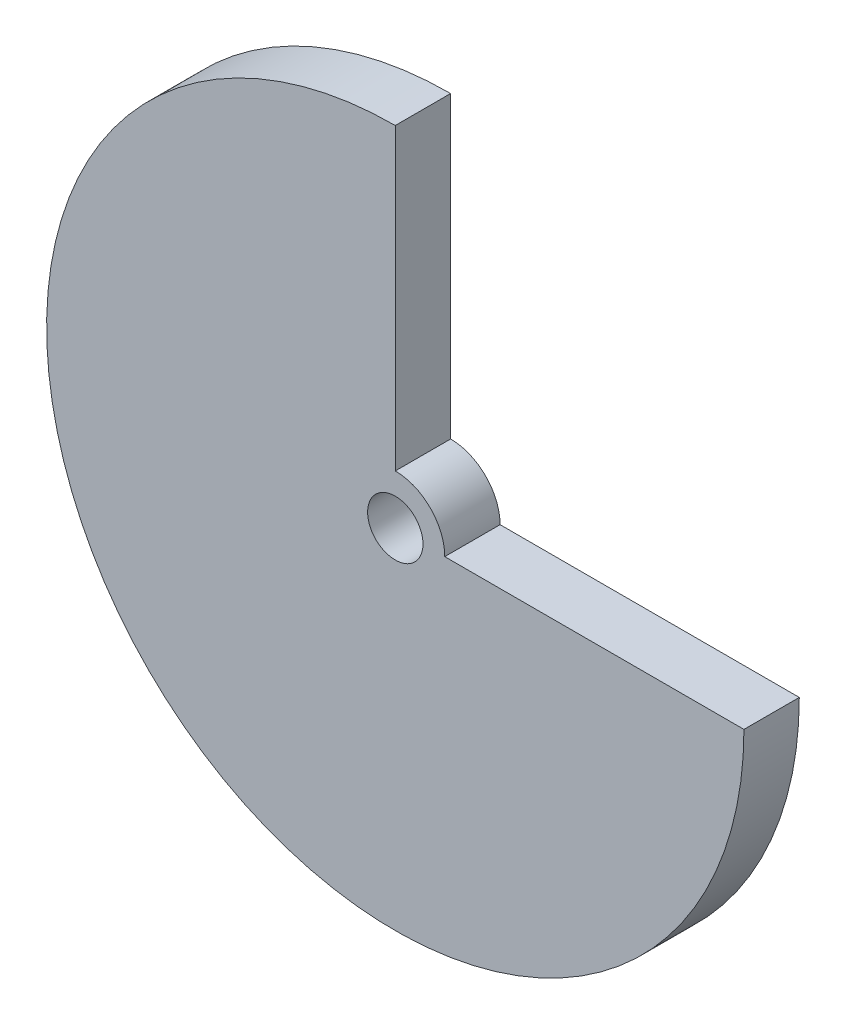
from build123d import *

# Parameters (mm, degrees)
BOSS_EXTRUDE1_DEPTH     = 6.35
CUT_EXTRUDE1_DEPTH      = 57.9238307
CUT_EXTRUDE1_DEPTH_BACK = 57.9238307
SKETCH2_R               = 3.175


with BuildPart() as part:
    # Sketch1 → Boss-Extrude1 (new body)
    with BuildSketch(Plane.XY):
        with BuildLine():
            Line((5.674999953, 0), (40.00000001, 0))
            ThreePointArc((40.00000001, 0), (-28.284271255, -28.284271255), (0, 40.00000001))
            Line((0, 40.00000001), (0, 5.674999953))
            ThreePointArc((0, 5.674999953), (4.01283095, 4.01283095), (5.674999953, 0))
        make_face()
    extrude(amount=BOSS_EXTRUDE1_DEPTH)

    # Sketch2 → Cut-Extrude1 (cut, two sides: drawn at the far end of the back side and taken through both)
    with BuildSketch(Plane.XY.offset(6.35).offset(-CUT_EXTRUDE1_DEPTH_BACK)):
        Circle(SKETCH2_R)
    extrude(amount=CUT_EXTRUDE1_DEPTH + CUT_EXTRUDE1_DEPTH_BACK, mode=Mode.SUBTRACT)


solid = part.part
